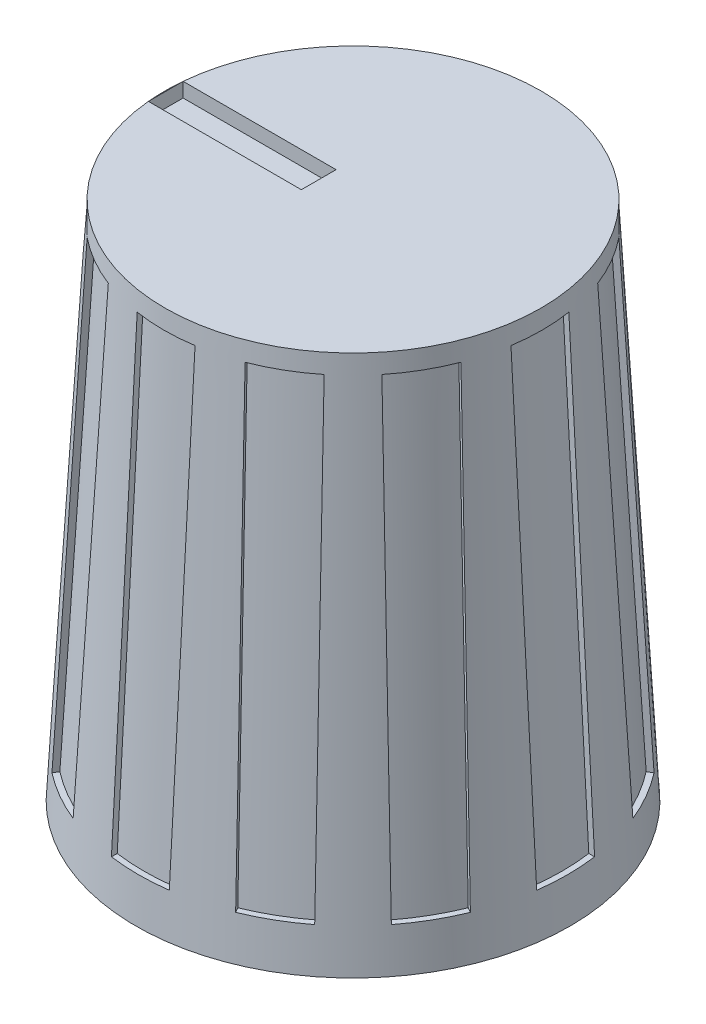
from build123d import *

# Parameters (mm, degrees)
ENL_V_MAT_EXTRU_1_REACH      = 28.401
ESQUISSE3_W                  = 2
ESQUISSE3_H                  = 15.856728551
ESQUISSE4_R                  = 2.95
ENL_V_MAT_EXTRU_2_DEPTH      = 6
ENL_V_MAT_EXTRU_2_DRAFT      = -3
R_P_TITION_CIRCULAIRE4_COUNT = 12
ESQUISSE5_W                  = 5.287177124
ESQUISSE5_H                  = 1.2
ENL_V_MAT_EXTRU_3_DEPTH      = 2.5


with BuildPart() as part:
    # Esquisse1 → Révolution1 (revolve)
    with BuildSketch(Plane.XY):
        Polygon((0, 0), (-7.5, 0), (-6.5, 18), (0, 18), align=None)
    revolve(axis=Axis((0, 18, 0), (0, -1, 0)))

    # Enlèv. mat.-Extru.1: from a cone face, 28.401 long prism both ways, kept between that surface and its translate by the depth
    enl_v_mat_extru_1_start = Plane(origin=(0, 9.428364, 0), z_dir=(0, -1, 0)) * Cone(4.983024111, 8.969379889, 71.754404, mode=Mode.PRIVATE)
    enl_v_mat_extru_1_end = Plane(origin=(0, 9.428364, -0.2), z_dir=(0, -1, 0)) * Cone(4.983024111, 8.969379889, 71.754404, mode=Mode.PRIVATE)
    # Esquisse3 → Enlèv. mat.-Extru.1 (cut, from a surface)
    with BuildSketch(Plane.XY.offset(10), mode=Mode.PRIVATE) as enl_v_mat_extru_1_sk1:
        with Locations((0, 9.428364275)):
            Rectangle(ESQUISSE3_W, ESQUISSE3_H)
    enl_v_mat_extru_1_tool1 = extrude(enl_v_mat_extru_1_sk1.sketch, amount=ENL_V_MAT_EXTRU_1_REACH, both=True, mode=Mode.PRIVATE)
    enl_v_mat_extru_1 = ((enl_v_mat_extru_1_tool1 & enl_v_mat_extru_1_start) - enl_v_mat_extru_1_end).solids().sort_by_distance((0, 9.428364, 6.803862))[0]
    add(enl_v_mat_extru_1, mode=Mode.SUBTRACT)


with BuildPart() as enl_v_mat_extru_2_tool:
    # Esquisse4 → Enlèv. mat.-Extru.2 (with draft: the straight prism first)
    with BuildSketch(Plane.XZ):
        Circle(ESQUISSE4_R)
    extrude(amount=-ENL_V_MAT_EXTRU_2_DEPTH)
    # Enlèv. mat.-Extru.2: the draft: its side faces are tilted about the plane it starts from
    enl_v_mat_extru_2_sides = [enl_v_mat_extru_2_tool.faces().sort_by_distance(p)[0] for p in [
        (-2.95, 3, 0),
    ]]
    draft(enl_v_mat_extru_2_sides, Plane.XZ, ENL_V_MAT_EXTRU_2_DRAFT)


with BuildPart() as part_1:
    add(part.part)

    # Enlèv. mat.-Extru.2: cut by enl_v_mat_extru_2_tool
    add(enl_v_mat_extru_2_tool.part, mode=Mode.SUBTRACT)

    # Répétition circulaire4: Enlèv. mat.-Extru.1 ×12 about axis
    r_p_tition_circulaire4_axis = Axis((0, 0, 0), (0, 1, 0))
    for i in range(1, R_P_TITION_CIRCULAIRE4_COUNT):
        add(enl_v_mat_extru_1.rotate(r_p_tition_circulaire4_axis, i * 360 / R_P_TITION_CIRCULAIRE4_COUNT), mode=Mode.SUBTRACT)

    # Esquisse5 → Enlèv. mat.-Extru.3 (cut)
    with BuildSketch(Plane(origin=(0, 20, 0), x_dir=(1, 0, 0), z_dir=(0, 1, 0))):
        with Locations((-3.828659888, 0)):
            Rectangle(ESQUISSE5_W, ESQUISSE5_H)
    extrude(amount=-ENL_V_MAT_EXTRU_3_DEPTH, mode=Mode.SUBTRACT)


solid = part_1.part
